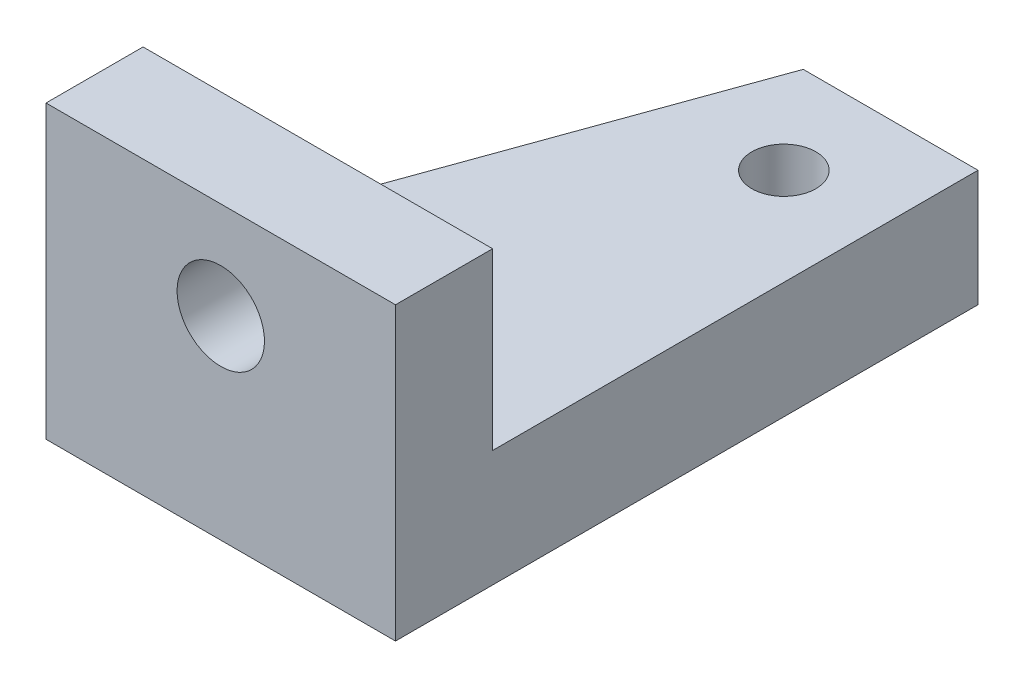
from build123d import *

# Parameters (mm, degrees)
EXTRUDE_1_DEPTH          = 9
HOLE_WIZARD_M4_1_D       = 3.3
CUT_EXTRUDE_1_DEPTH      = 35.727510708
CUT_EXTRUDE_1_DEPTH_BACK = 35.727510708
HOLE_WIZARD_M4_1_2_D     = 4.5


with BuildPart() as part:
    # 草图1 → 凸台-拉伸1 (new, symmetric)
    with BuildSketch(Plane(origin=(0, 0, 0), x_dir=(0, 0, -1), z_dir=(1, 0, 0))):
        Polygon((0, 0), (0, 15), (5, 15), (5, 6), (30, 6), (30, 0), align=None)
    extrude(amount=EXTRUDE_1_DEPTH, both=True)

    # Hole Wizard M4 _1 (through all)
    with Locations(Plane(origin=(0, 0, 0), x_dir=(-1, 0, 0), z_dir=(0, -1, 0))):
        with Locations((-4, 25)):
            Hole(HOLE_WIZARD_M4_1_D / 2)

    # 草图4 → 切除-拉伸1 (cut, two sides: drawn at the far end of the back side and taken through both)
    with BuildSketch(Plane.XZ.offset(-CUT_EXTRUDE_1_DEPTH_BACK)):
        Polygon((24.605205099, -98.34779194), (0, -30), (-9, -5), (-33.605205099, 63.34779194), (-170.300788979, 14.137381743), (-112.090378782, -147.558202137), align=None)
    extrude(amount=CUT_EXTRUDE_1_DEPTH + CUT_EXTRUDE_1_DEPTH_BACK, mode=Mode.SUBTRACT)

    # Hole Wizard M4 _1 2 (through all)
    with Locations(Plane(origin=(0, 0, -5), x_dir=(-1, 0, 0), z_dir=(0, 0, -1))):
        with Locations((0, 10)):
            Hole(HOLE_WIZARD_M4_1_2_D / 2)


solid = part.part
